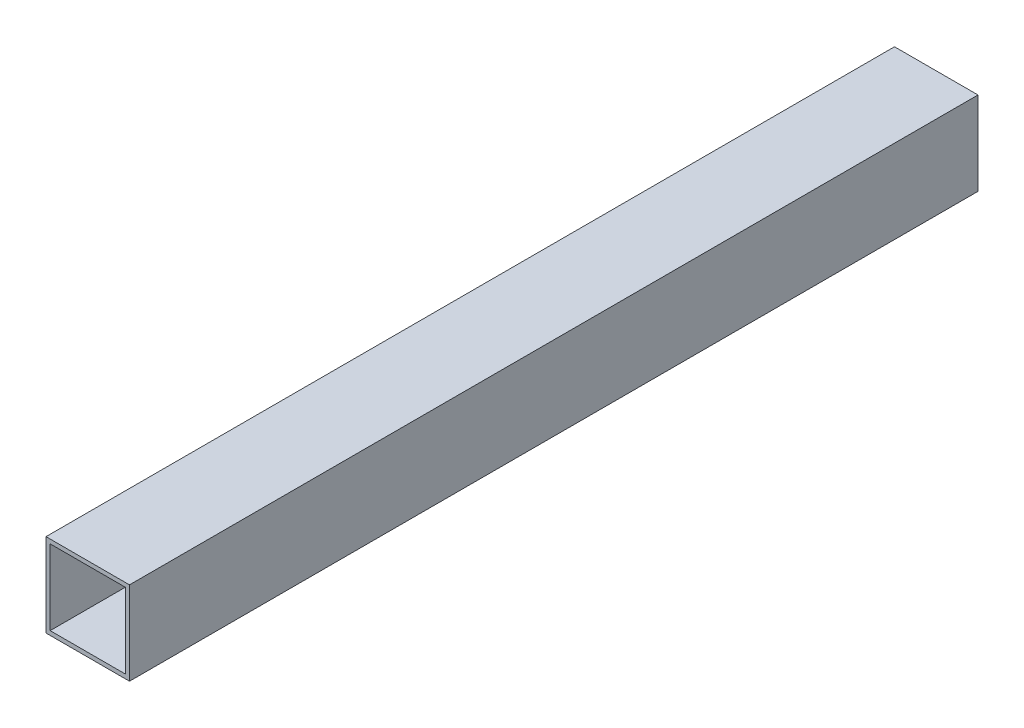
from build123d import *

# Parameters (mm, degrees)
CROQUIS1_W            = 40
CROQUIS1_H            = 40
CROQUIS1_W_2          = 36
CROQUIS1_H_2          = 36
EXTRUIR_L_MINA1_DEPTH = 406.5


with BuildPart() as part:
    # Croquis1 → Extruir-Lámina1 (new body)
    with BuildSketch(Plane.XY):
        Rectangle(CROQUIS1_W, CROQUIS1_H)
        Rectangle(CROQUIS1_W_2, CROQUIS1_H_2, mode=Mode.SUBTRACT)
    extrude(amount=EXTRUIR_L_MINA1_DEPTH)


solid = part.part
